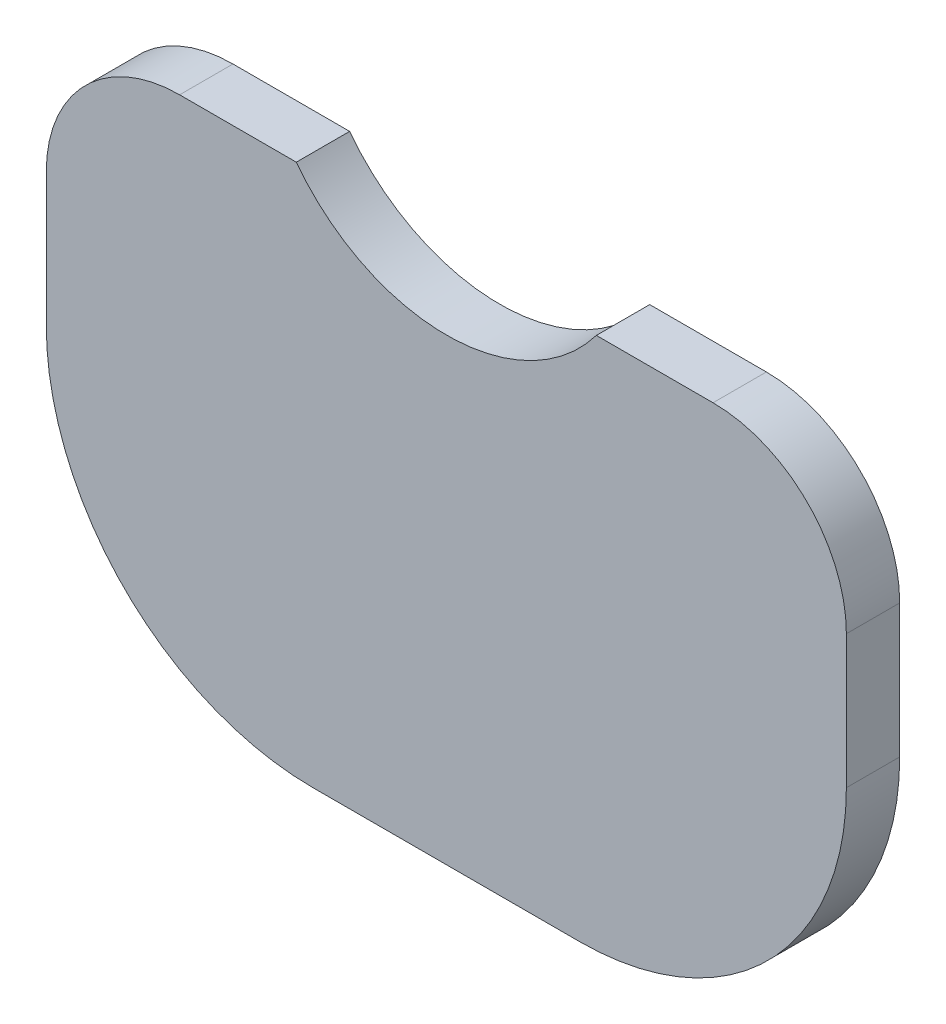
from build123d import *

# Parameters (mm, degrees)
EXTRUDE_1_DEPTH = 4
SKETCH_3_R      = 7.5
EXTRUDE_2_DEPTH = 6.5


with BuildPart() as part:
    # 草图1 → 凸台-拉伸1 (new body)
    with BuildSketch(Plane.XY):
        with BuildLine():
            Line((-10, -20), (10, -20))
            ThreePointArc((10, -20), (24.142135624, -14.142135624), (30, 0))
            Line((30, 0), (30, 10))
            ThreePointArc((30, 10), (27.071067812, 17.071067812), (20, 20))
            Line((20, 20), (11.249888888, 20))
            ThreePointArc((11.249888888, 20), (0, 14.4), (-11.249888888, 20))
            Line((-11.249888888, 20), (-20, 20))
            ThreePointArc((-20, 20), (-27.071067812, 17.071067812), (-30, 10))
            Line((-30, 10), (-30, 0))
            ThreePointArc((-30, 0), (-24.142135624, -14.142135624), (-10, -20))
        make_face()
    extrude(amount=EXTRUDE_1_DEPTH)

    # 草图3 → 凸台-拉伸2 (add)
    with BuildSketch(Plane.XY):
        with Locations((-12.5, 0)):
            Circle(SKETCH_3_R)
        with Locations((12.5, 0)):
            Circle(SKETCH_3_R)
    extrude(amount=-EXTRUDE_2_DEPTH)


solid = part.part
